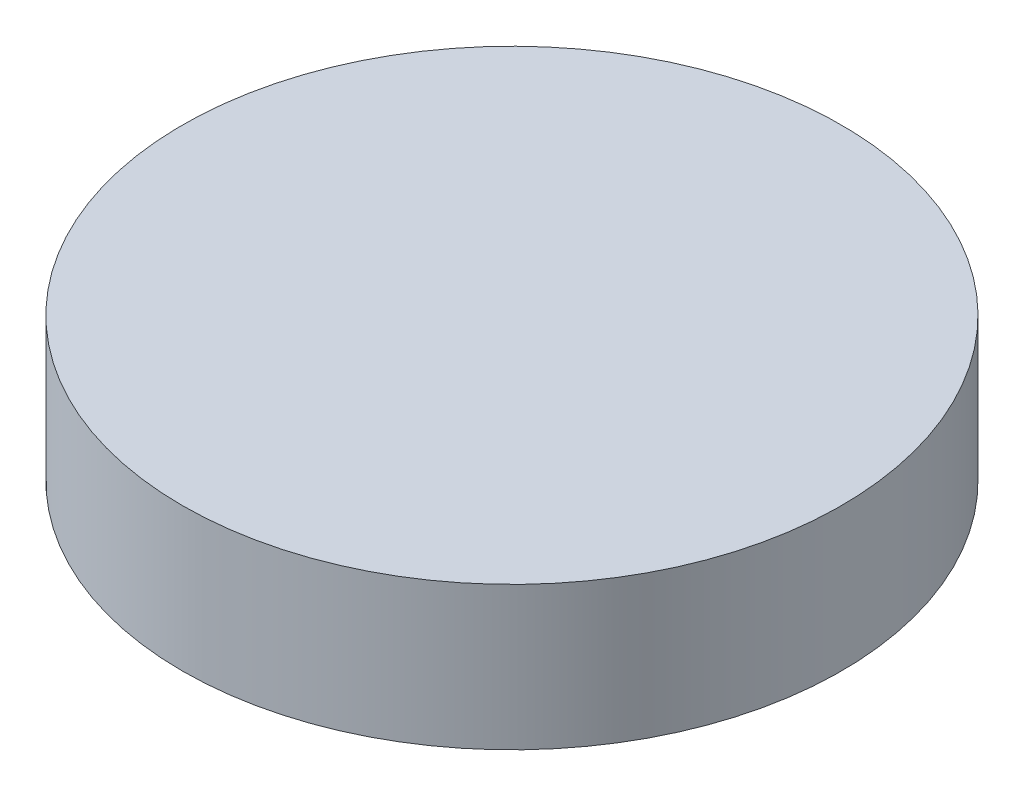
from build123d import *


with BuildPart() as part:
    # Croquis2 → Revolución1 (revolve)
    with BuildSketch(Plane.XY, mode=Mode.PRIVATE) as revoluci_n1_sk:
        Polygon((-91.414024071, -2.724751439), (-92.914024071, -2.724751439), (-92.914024071, 4.775248561), (-75.664024071, 4.775248561), (-75.664024071, 3.275248561), (-91.414024071, 3.275248561), align=None)
    revolve(revoluci_n1_sk.sketch.rotate(Axis((-75.664024071, 4.775248561, 0), (0, -1, 0)), 270), axis=Axis((-75.664024071, 4.775248561, 0), (0, -1, 0)))


solid = part.part
